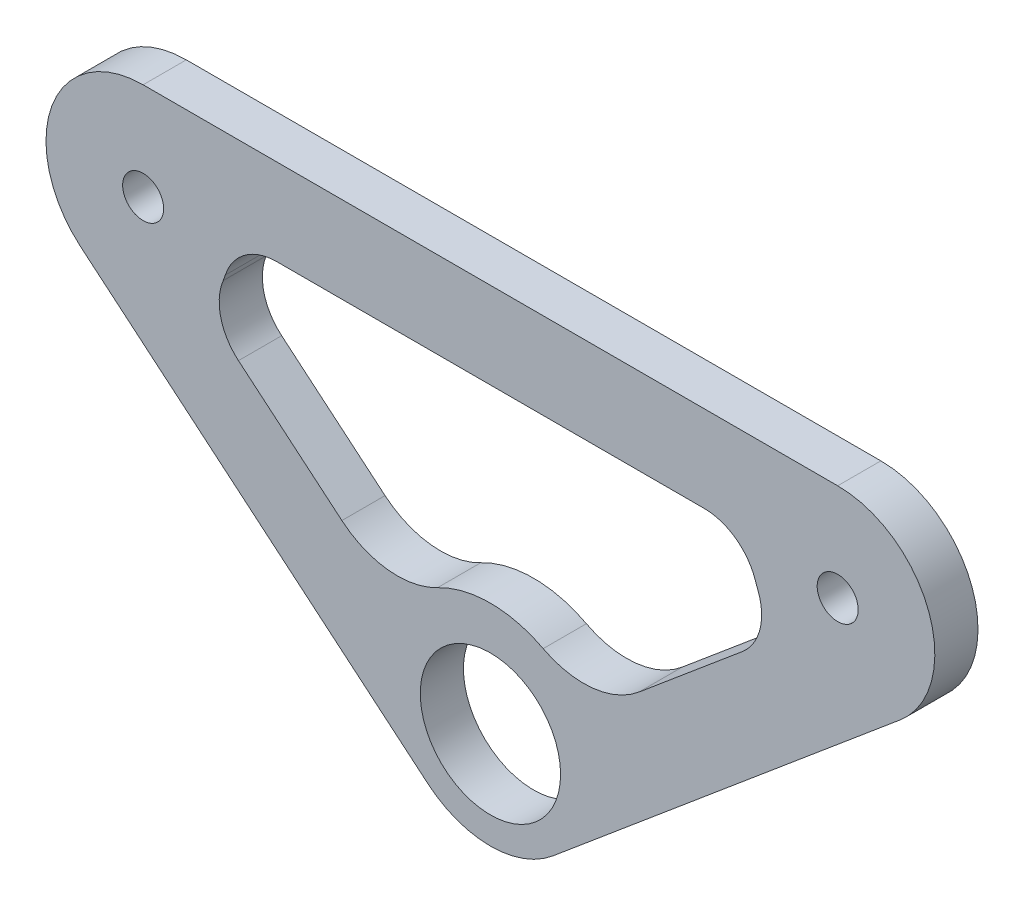
from build123d import *

# Parameters (mm, degrees)
SKETCH_1_R      = 6.5
SKETCH_1_R_2    = 1.9
EXTRUDE_1_DEPTH = 4


with BuildPart() as part:
    # 草图1 → 凸台-拉伸1 (new body)
    with BuildSketch(Plane.XY):
        with BuildLine():
            Line((-32.173866611, 35.997079607), (32.173866611, 35.997079607))
            ThreePointArc((32.173866611, 35.997079607), (40.631100198, 30.075260897), (37.958955098, 20.102679619))
            Line((37.958955098, 20.102679619), (5.785088487, -6.894399988))
            ThreePointArc((5.785088487, -6.894399988), (0, -9), (-5.785088487, -6.894399988))
            Line((-5.785088487, -6.894399988), (-37.958955098, 20.102679619))
            ThreePointArc((-37.958955098, 20.102679619), (-40.631100198, 30.075260897), (-32.173866611, 35.997079607))
        make_face()
        Circle(SKETCH_1_R, mode=Mode.SUBTRACT)
        with Locations((32.173866611, 26.997079607)):
            Circle(SKETCH_1_R_2, mode=Mode.SUBTRACT)
        with Locations((-32.173866611, 26.997079607)):
            Circle(SKETCH_1_R_2, mode=Mode.SUBTRACT)
        with BuildLine():
            Line((23.341207762, 18.280191535), (13.760949221, 10.241400126))
            ThreePointArc((13.760949221, 10.241400126), (9.471070536, 8.415299285), (4.891665276, 9.290942408))
            ThreePointArc((4.891665276, 9.290942408), (0, 10.5), (-4.891665276, 9.290942408))
            ThreePointArc((-4.891665276, 9.290942408), (-9.471070536, 8.415299285), (-13.760949221, 10.241400126))
            Line((-13.760949221, 10.241400126), (-23.341207762, 18.280191535))
            ThreePointArc((-23.341207762, 18.280191535), (-24.979589386, 20.904182513), (-24.760576213, 23.989900618))
            ThreePointArc((-24.760576213, 23.989900618), (-24.656325645, 24.26091846), (-24.561979302, 24.535541145))
            ThreePointArc((-24.561979302, 24.535541145), (-22.746291761, 27.040117307), (-19.804549734, 27.997079607))
            Line((-19.804549734, 27.997079607), (19.804549734, 27.997079607))
            ThreePointArc((19.804549734, 27.997079607), (22.746291761, 27.040117307), (24.561979302, 24.535541145))
            ThreePointArc((24.561979302, 24.535541145), (24.656325645, 24.26091846), (24.760576213, 23.989900618))
            ThreePointArc((24.760576213, 23.989900618), (24.979589386, 20.904182513), (23.341207762, 18.280191535))
        make_face(mode=Mode.SUBTRACT)
    extrude(amount=EXTRUDE_1_DEPTH)


solid = part.part
